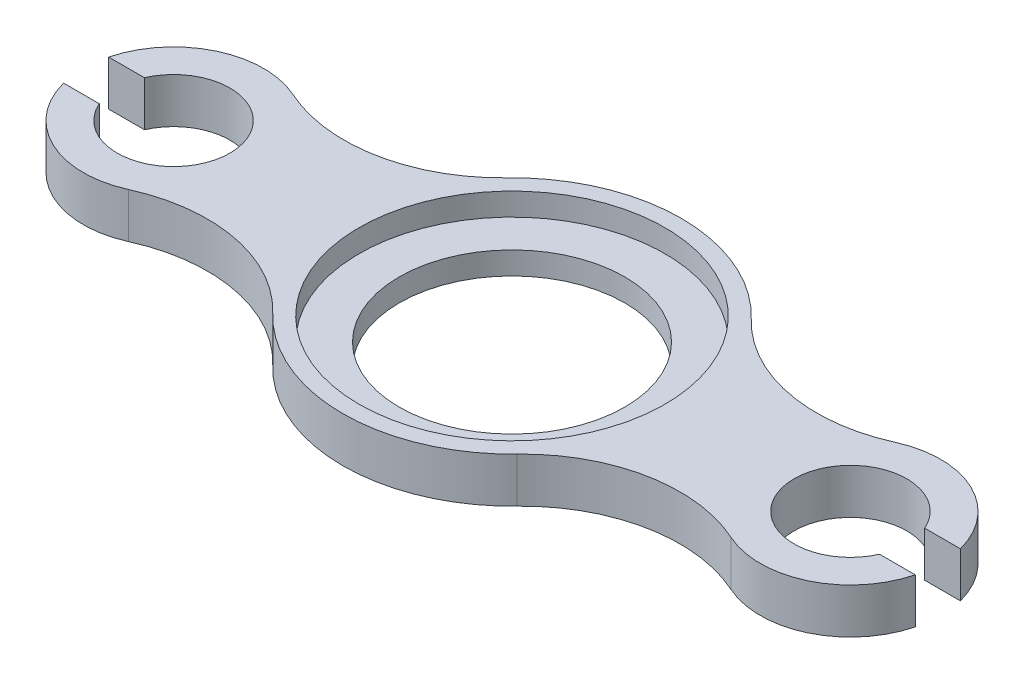
from build123d import *

# Parameters (mm, degrees)
ESQUISSE1_R             = 50
BOSS_EXTRU_1_DEPTH      = 20
ESQUISSE2_R             = 67.8
ENL_V_MAT_EXTRU_1_DEPTH = 10


with BuildPart() as part:
    # Esquisse1 → Boss.-Extru.1 (new body)
    with BuildSketch(Plane(origin=(0, 0, 0), x_dir=(1, 0, 0), z_dir=(0, 1, 0))):
        with BuildLine():
            Line((172.912878475, 10), (188.729833462, 10))
            ThreePointArc((188.729833462, 10), (167.293491098, 36.068478837), (133.545454545, 36.458852613))
            ThreePointArc((133.545454545, 36.458852613), (91.415195679, 31.543703023), (54.181034483, 51.859574838))
            ThreePointArc((54.181034483, 51.859574838), (0, 75), (-54.181034483, 51.859574838))
            ThreePointArc((-54.181034483, 51.859574838), (-91.415195679, 31.543703023), (-133.545454545, 36.458852613))
            ThreePointArc((-133.545454545, 36.458852613), (-167.293491098, 36.068478837), (-188.729833462, 10))
            Line((-188.729833462, 10), (-172.912878475, 10))
            ThreePointArc((-172.912878475, 10), (-125, 0), (-172.912878475, -10))
            Line((-172.912878475, -10), (-188.729833462, -10))
            ThreePointArc((-188.729833462, -10), (-167.293491098, -36.068478837), (-133.545454545, -36.458852613))
            ThreePointArc((-133.545454545, -36.458852613), (-91.415195679, -31.543703023), (-54.181034483, -51.859574838))
            ThreePointArc((-54.181034483, -51.859574838), (0, -75), (54.181034483, -51.859574838))
            ThreePointArc((54.181034483, -51.859574838), (91.415195679, -31.543703023), (133.545454545, -36.458852613))
            ThreePointArc((133.545454545, -36.458852613), (167.293491098, -36.068478837), (188.729833462, -10))
            Line((188.729833462, -10), (172.912878475, -10))
            ThreePointArc((172.912878475, -10), (125, 0), (172.912878475, 10))
        make_face()
        with Locations(Location((0, 0, 0), (0, 0, 270))):
            Circle(ESQUISSE1_R, mode=Mode.SUBTRACT)
    extrude(amount=BOSS_EXTRU_1_DEPTH)

    # Esquisse2 → Enlèv. mat.-Extru.1 (cut)
    with BuildSketch(Plane(origin=(0, 20, 0), x_dir=(1, 0, 0), z_dir=(0, 1, 0))):
        with Locations(Location((0, 0, 0), (0, 0, 270))):
            Circle(ESQUISSE2_R)
    extrude(amount=-ENL_V_MAT_EXTRU_1_DEPTH, mode=Mode.SUBTRACT)


solid = part.part
